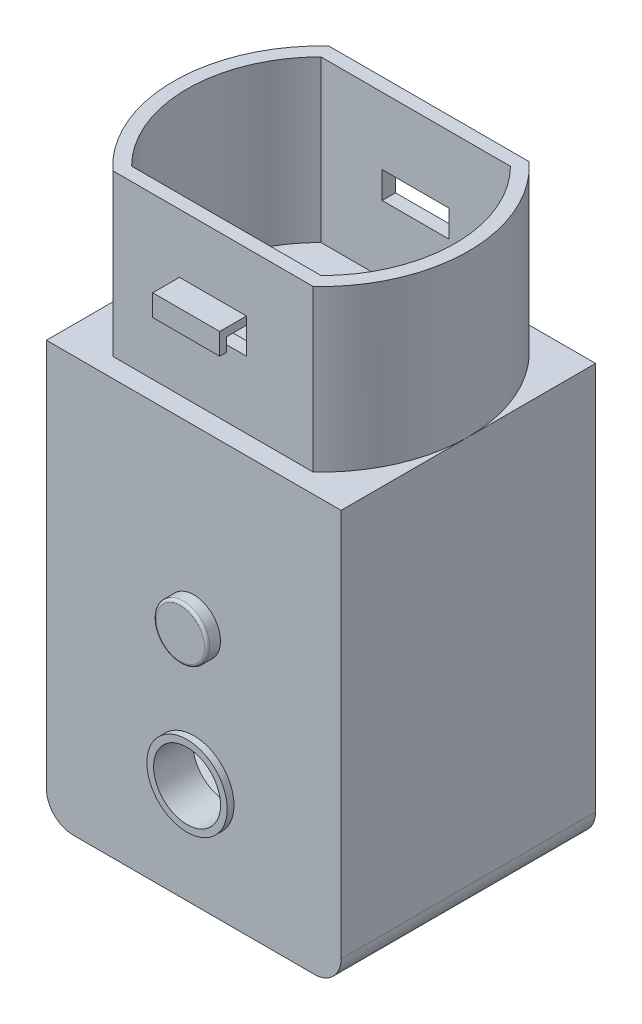
from build123d import *

# Parameters (mm, degrees)
BOSS_EXTRUDE1_DEPTH = 9.5
SKETCH3_W           = 4
SKETCH3_H           = 5
SKETCH3_R           = 1.568232158
BOSS_EXTRUDE2_DEPTH = 0.5
BOSS_EXTRUDE3_DEPTH = 12
SKETCH5_W           = 5
SKETCH5_H           = 2
CUT_EXTRUDE1_DEPTH  = 35.435518568
SKETCH6_R           = 2.5
CUT_EXTRUDE2_DEPTH  = 36.18877662
BOSS_EXTRUDE4_START = 0.5
SKETCH7_R           = 3
SKETCH7_R_2         = 2.5
BOSS_EXTRUDE4_DEPTH = 0.5
SKETCH8_R           = 2
BOSS_EXTRUDE5_DEPTH = 1
FILLET1_R           = 0.2
CUT_EXTRUDE3_START  = -28
CUT_EXTRUDE3_DEPTH  = 28
BOSS_EXTRUDE6_START = -1
SKETCH10_R          = 3.543625457
BOSS_EXTRUDE6_DEPTH = 1
SKETCH11_W          = 5
SKETCH11_H          = 0.6
BOSS_EXTRUDE7_DEPTH = 2
SKETCH12_W          = 5
SKETCH12_H          = 0.5
BOSS_EXTRUDE8_DEPTH = 1


with BuildPart() as part:
    # Sketch2 → Boss-Extrude1 (new, symmetric)
    with BuildSketch(Plane.XY):
        with BuildLine():
            Line((-11, 15.5), (11, 15.5))
            Line((11, 15.5), (11, -13.5))
            ThreePointArc((11, -13.5), (10.414213562, -14.914213562), (9, -15.5))
            Line((9, -15.5), (-9, -15.5))
            ThreePointArc((-9, -15.5), (-10.414213562, -14.914213562), (-11, -13.5))
            Line((-11, -13.5), (-11, 15.5))
        make_face()
    extrude(amount=BOSS_EXTRUDE1_DEPTH, both=True)

    # Sketch4 → Boss-Extrude3 (add)
    with BuildSketch(Plane(origin=(0, 15.5, 0), x_dir=(1, 0, 0), z_dir=(0, 1, 0))):
        with BuildLine():
            Line((-7.479570046, 8.065731953), (7.479570046, 8.065731953))
            ThreePointArc((7.479570046, 8.065731953), (11, 0), (7.479570046, -8.065731953))
            Line((7.479570046, -8.065731953), (-7.479570046, -8.065731953))
            ThreePointArc((-7.479570046, -8.065731953), (-11, 0), (-7.479570046, 8.065731953))
        make_face()
        with BuildLine():
            Line((-7.076399648, 7.065731953), (7.076399648, 7.065731953))
            ThreePointArc((7.076399648, 7.065731953), (10, 0), (7.076399648, -7.065731953))
            Line((7.076399648, -7.065731953), (-7.076399648, -7.065731953))
            ThreePointArc((-7.076399648, -7.065731953), (-10, 0), (-7.076399648, 7.065731953))
        make_face(mode=Mode.SUBTRACT)
    extrude(amount=BOSS_EXTRUDE3_DEPTH)

    # Sketch5 → Cut-Extrude1 (cut, through all)
    with BuildSketch(Plane(origin=(0, 0, -8.065731953), x_dir=(-1, 0, 0), z_dir=(0, 0, -1))):
        with Locations((0, 21.5)):
            Rectangle(SKETCH5_W, SKETCH5_H)
    extrude(amount=-CUT_EXTRUDE1_DEPTH, mode=Mode.SUBTRACT)

    # Sketch6 → Cut-Extrude2 (cut, through all)
    with BuildSketch(Plane.XY.offset(9.5)):
        with Locations((0, -7.564295089)):
            Circle(SKETCH6_R)
    extrude(amount=-CUT_EXTRUDE2_DEPTH, mode=Mode.SUBTRACT)

    # Sketch7 → Boss-Extrude4 (add)
    with BuildSketch(Plane.XY.offset(9.5).offset(BOSS_EXTRUDE4_START)):
        with Locations(Location((0, -7.564295089, 0), (0, 0, 180))):
            Circle(SKETCH7_R)
        with Locations((0, -7.564295089)):
            Circle(SKETCH7_R_2, mode=Mode.SUBTRACT)
    extrude(amount=-BOSS_EXTRUDE4_DEPTH)

    # Sketch8 → Boss-Extrude5 (add)
    with BuildSketch(Plane.XY.offset(9.5)):
        with Locations(Location((0, 2.544370002, 0), (0, 0, 180))):
            Circle(SKETCH8_R)
    extrude(amount=BOSS_EXTRUDE5_DEPTH)

    # Fillet1
    fillet1_edges = [part.edges().sort_by_distance(p)[0] for p in [
        (2, 2.544370002, 10.5),
    ]]
    fillet(fillet1_edges, radius=FILLET1_R)

    # Sketch9 → Cut-Extrude3 (cut)
    with BuildSketch(Plane(origin=(0, 15.5, 0), x_dir=(1, 0, 0), z_dir=(0, 1, 0)).offset(CUT_EXTRUDE3_START)):
        with BuildLine():
            Line((7.076399648, 7.065731953), (-7.076399648, 7.065731953))
            ThreePointArc((-7.076399648, 7.065731953), (-10, 0), (-7.076399648, -7.065731953))
            Line((-7.076399648, -7.065731953), (7.076399648, -7.065731953))
            ThreePointArc((7.076399648, -7.065731953), (10, 0), (7.076399648, 7.065731953))
        make_face()
    extrude(amount=CUT_EXTRUDE3_DEPTH, mode=Mode.SUBTRACT)

    # Sketch10 → Boss-Extrude6 (add)
    with BuildSketch(Plane(origin=(0, 15.5, 0), x_dir=(1, 0, 0), z_dir=(0, 1, 0)).offset(BOSS_EXTRUDE6_START)):
        with BuildLine():
            Line((7.479570046, 8.065731953), (-7.479570046, 8.065731953))
            ThreePointArc((-7.479570046, 8.065731953), (-10.081549249, 4.400268713), (-11, 0))
            ThreePointArc((-11, 0), (-10.081549249, -4.400268713), (-7.479570046, -8.065731953))
            Line((-7.479570046, -8.065731953), (7.479570046, -8.065731953))
            ThreePointArc((7.479570046, -8.065731953), (10.081549249, -4.400268713), (11, 0))
            ThreePointArc((11, 0), (10.081549249, 4.400268713), (7.479570046, 8.065731953))
        make_face()
        with Locations(Location((0, 0, 0), (0, 0, 270))):
            Circle(SKETCH10_R, mode=Mode.SUBTRACT)
    extrude(amount=BOSS_EXTRUDE6_DEPTH)

    # Sketch11 → Boss-Extrude7 (add)
    with BuildSketch(Plane(origin=(0, 0, -8.065731953), x_dir=(-1, 0, 0), z_dir=(0, 0, -1))):
        with Locations((0, 22.8)):
            Rectangle(SKETCH11_W, SKETCH11_H)
    boss_extrude7 = extrude(amount=BOSS_EXTRUDE7_DEPTH)

    # Sketch12 → Boss-Extrude8 (add)
    with BuildSketch(Plane.XZ.offset(-22.5)):
        with Locations((0, -9.815731953)):
            Rectangle(SKETCH12_W, SKETCH12_H)
    boss_extrude8 = extrude(amount=BOSS_EXTRUDE8_DEPTH)

    # Mirror1: Boss-Extrude7, Boss-Extrude8 across plane
    add(boss_extrude7.mirror(Plane.XY))
    add(boss_extrude8.mirror(Plane.XY))


with BuildPart() as body_2:
    # Sketch3 → Boss-Extrude2 (new, symmetric)
    with BuildSketch(Plane.XY):
        with Locations((0, -18.013524238)):
            Rectangle(SKETCH3_W, SKETCH3_H)
        with Locations((0, -18.013524238)):
            Circle(SKETCH3_R, mode=Mode.SUBTRACT)
    extrude(amount=BOSS_EXTRUDE2_DEPTH, both=True)


solid = Compound([part.part, body_2.part])
